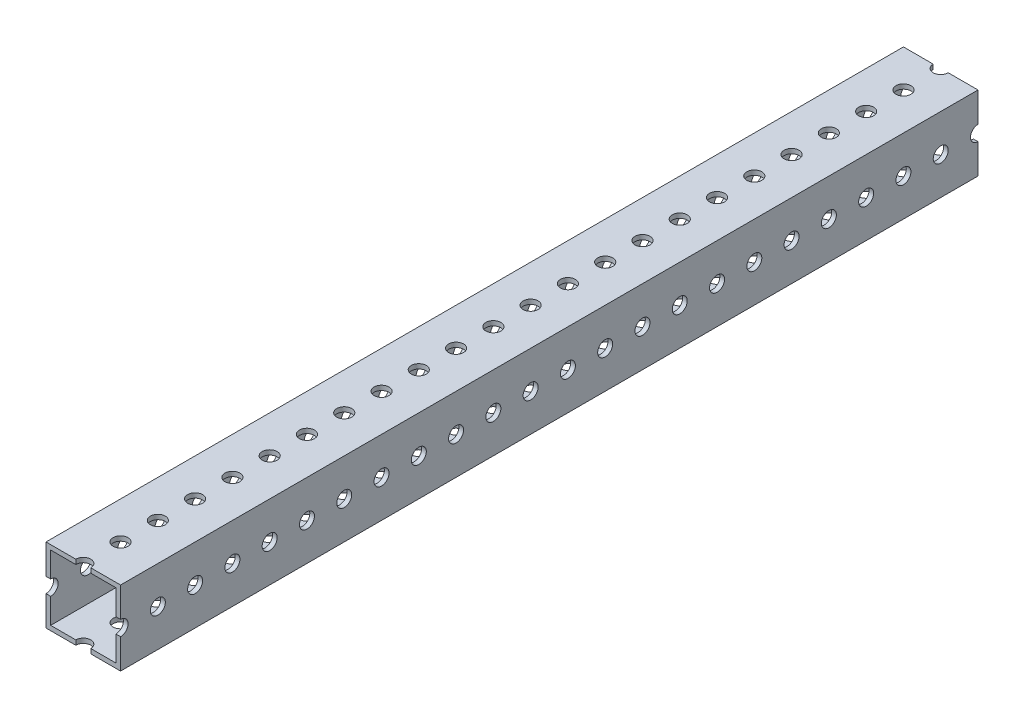
from build123d import *

# Parameters (mm, degrees)
SKETCH1_W           = 25.4
SKETCH1_H           = 25.4
SKETCH1_W_2         = 22.225
SKETCH1_H_2         = 22.225
BOSS_EXTRUDE1_DEPTH = 292.1
SKETCH2_R           = 2.5527
CUT_EXTRUDE1_DEPTH  = 294.477188211
SKETCH3_R           = 2.5527
CUT_EXTRUDE2_DEPTH  = 294.477188211


with BuildPart() as part:
    # Sketch1 → Boss-Extrude1 (new body)
    with BuildSketch(Plane.XY):
        Rectangle(SKETCH1_W, SKETCH1_H)
        Rectangle(SKETCH1_W_2, SKETCH1_H_2, mode=Mode.SUBTRACT)
    extrude(amount=BOSS_EXTRUDE1_DEPTH)

    # Sketch2 → Cut-Extrude1 (cut, through all)
    with BuildSketch(Plane(origin=(0, 12.7, 0), x_dir=(1, 0, 0), z_dir=(0, 1, 0))):
        Circle(SKETCH2_R)
        with Locations(Location((0, -12.7, 0), (0, 0, 270))):
            Circle(SKETCH2_R)
        with Locations(Location((0, -25.4, 0), (0, 0, 270))):
            Circle(SKETCH2_R)
        with Locations(Location((0, -38.1, 0), (0, 0, 270))):
            Circle(SKETCH2_R)
        with Locations(Location((0, -50.8, 0), (0, 0, 270))):
            Circle(SKETCH2_R)
        with Locations(Location((0, -63.5, 0), (0, 0, 270))):
            Circle(SKETCH2_R)
        with Locations(Location((0, -76.2, 0), (0, 0, 270))):
            Circle(SKETCH2_R)
        with Locations(Location((0, -88.9, 0), (0, 0, 270))):
            Circle(SKETCH2_R)
        with Locations(Location((0, -101.6, 0), (0, 0, 270))):
            Circle(SKETCH2_R)
        with Locations(Location((0, -114.3, 0), (0, 0, 270))):
            Circle(SKETCH2_R)
        with Locations(Location((0, -127, 0), (0, 0, 270))):
            Circle(SKETCH2_R)
        with Locations(Location((0, -139.7, 0), (0, 0, 270))):
            Circle(SKETCH2_R)
        with Locations(Location((0, -152.4, 0), (0, 0, 270))):
            Circle(SKETCH2_R)
        with Locations(Location((0, -165.1, 0), (0, 0, 270))):
            Circle(SKETCH2_R)
        with Locations(Location((0, -177.8, 0), (0, 0, 270))):
            Circle(SKETCH2_R)
        with Locations(Location((0, -190.5, 0), (0, 0, 270))):
            Circle(SKETCH2_R)
        with Locations(Location((0, -203.2, 0), (0, 0, 270))):
            Circle(SKETCH2_R)
        with Locations(Location((0, -215.9, 0), (0, 0, 270))):
            Circle(SKETCH2_R)
        with Locations(Location((0, -228.6, 0), (0, 0, 270))):
            Circle(SKETCH2_R)
        with Locations(Location((0, -241.3, 0), (0, 0, 270))):
            Circle(SKETCH2_R)
        with Locations(Location((0, -254, 0), (0, 0, 270))):
            Circle(SKETCH2_R)
        with Locations(Location((0, -266.7, 0), (0, 0, 270))):
            Circle(SKETCH2_R)
        with Locations(Location((0, -279.4, 0), (0, 0, 270))):
            Circle(SKETCH2_R)
        with Locations((0, -292.1)):
            Circle(SKETCH2_R)
        with Locations((0, -304.8)):
            Circle(SKETCH2_R)
        with Locations((0, -317.5)):
            Circle(SKETCH2_R)
    extrude(amount=-CUT_EXTRUDE1_DEPTH, mode=Mode.SUBTRACT)

    # Sketch3 → Cut-Extrude2 (cut, through all)
    with BuildSketch(Plane(origin=(12.7, 0, 0), x_dir=(0, 0, -1), z_dir=(1, 0, 0))):
        Circle(SKETCH3_R)
        with Locations(Location((-12.7, 0, 0), (0, 0, 90))):
            Circle(SKETCH3_R)
        with Locations(Location((-25.4, 0, 0), (0, 0, 90))):
            Circle(SKETCH3_R)
        with Locations(Location((-38.1, 0, 0), (0, 0, 90))):
            Circle(SKETCH3_R)
        with Locations(Location((-50.8, 0, 0), (0, 0, 90))):
            Circle(SKETCH3_R)
        with Locations(Location((-63.5, 0, 0), (0, 0, 90))):
            Circle(SKETCH3_R)
        with Locations(Location((-76.2, 0, 0), (0, 0, 90))):
            Circle(SKETCH3_R)
        with Locations(Location((-88.9, 0, 0), (0, 0, 90))):
            Circle(SKETCH3_R)
        with Locations(Location((-101.6, 0, 0), (0, 0, 90))):
            Circle(SKETCH3_R)
        with Locations(Location((-114.3, 0, 0), (0, 0, 90))):
            Circle(SKETCH3_R)
        with Locations(Location((-127, 0, 0), (0, 0, 90))):
            Circle(SKETCH3_R)
        with Locations(Location((-139.7, 0, 0), (0, 0, 90))):
            Circle(SKETCH3_R)
        with Locations(Location((-152.4, 0, 0), (0, 0, 90))):
            Circle(SKETCH3_R)
        with Locations(Location((-165.1, 0, 0), (0, 0, 90))):
            Circle(SKETCH3_R)
        with Locations(Location((-177.8, 0, 0), (0, 0, 90))):
            Circle(SKETCH3_R)
        with Locations(Location((-190.5, 0, 0), (0, 0, 90))):
            Circle(SKETCH3_R)
        with Locations(Location((-203.2, 0, 0), (0, 0, 90))):
            Circle(SKETCH3_R)
        with Locations(Location((-215.9, 0, 0), (0, 0, 90))):
            Circle(SKETCH3_R)
        with Locations(Location((-228.6, 0, 0), (0, 0, 90))):
            Circle(SKETCH3_R)
        with Locations(Location((-241.3, 0, 0), (0, 0, 90))):
            Circle(SKETCH3_R)
        with Locations(Location((-254, 0, 0), (0, 0, 90))):
            Circle(SKETCH3_R)
        with Locations(Location((-266.7, 0, 0), (0, 0, 90))):
            Circle(SKETCH3_R)
        with Locations(Location((-279.4, 0, 0), (0, 0, 90))):
            Circle(SKETCH3_R)
        with Locations((-292.1, 0)):
            Circle(SKETCH3_R)
        with Locations((-304.8, 0)):
            Circle(SKETCH3_R)
        with Locations((-317.5, 0)):
            Circle(SKETCH3_R)
    extrude(amount=-CUT_EXTRUDE2_DEPTH, mode=Mode.SUBTRACT)


solid = part.part
